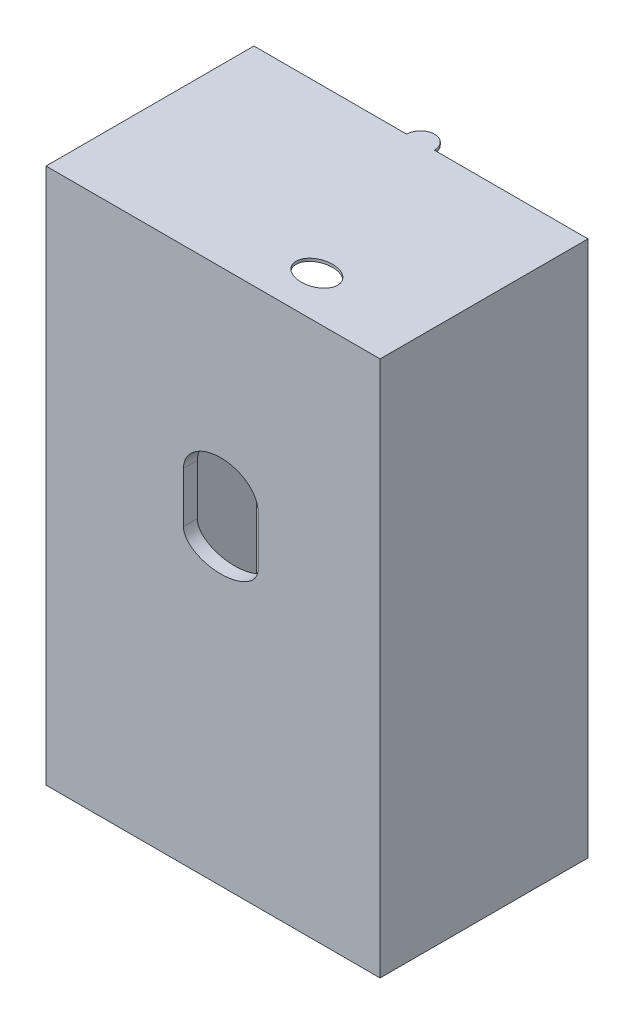
from build123d import *

# Parameters (mm, degrees)
SKETCH1_W               = 120.517011816
SKETCH1_H               = 193.423301163
BOSS_EXTRUDE1_DEPTH     = 75
SKETCH1_3_W             = 118.517011816
SKETCH1_3_H             = 191.423301163
CUT_EXTRUDE1_DEPTH      = 70
BOSS_EXTRUDE2_DEPTH     = 1
CUT_EXTRUDE4_DEPTH      = 137.495747048
CUT_EXTRUDE4_DEPTH_BACK = 137.495747048
CUT_EXTRUDE6_DEPTH      = 10


with BuildPart() as part:
    # Sketch1 → Boss-Extrude1 (new body)
    with BuildSketch(Plane.XY):
        with Locations((0.026299542, -0.057021664)):
            Rectangle(SKETCH1_W, SKETCH1_H)
    extrude(amount=BOSS_EXTRUDE1_DEPTH)

    # Sketch1<3> → Cut-Extrude1 (cut)
    with BuildSketch(Plane.XY):
        with Locations((0.026299542, -0.057021664)):
            Rectangle(SKETCH1_3_W, SKETCH1_3_H)
    extrude(amount=CUT_EXTRUDE1_DEPTH, mode=Mode.SUBTRACT)

    # Sketch2 → Boss-Extrude2 (add)
    with BuildSketch(Plane(origin=(0, 96.654628917, 0), x_dir=(1, 0, 0), z_dir=(0, 1, 0))):
        with BuildLine():
            Line((-5.120692539, 0), (4.878786885, 0))
            ThreePointArc((4.878786885, 0), (-0.120952827, 5.051017752), (-5.120692539, 0))
        make_face()
    extrude(amount=-BOSS_EXTRUDE2_DEPTH)

    # Sketch4<2> → Cut-Extrude4 (cut, two sides: drawn at the far end of the back side and taken through both)
    with BuildSketch(Plane(origin=(0, 0, 70), x_dir=(-1, 0, 0), z_dir=(0, 0, -1)).offset(-CUT_EXTRUDE4_DEPTH_BACK)):
        with BuildLine():
            Line((-16.236705508, 8.803847843), (-16.236705508, 26.966349614))
            add(Edge.make_bspline(
                [(10.654600955, 26.966349614), (10.654600955, 37.042694246), (-2.791052277, 37.042694246), (-16.236705508, 37.042694246), (-16.236705508, 26.966349614)],
                knots=[3.141592654, 3.141592654, 3.141592654, 4.71238898, 4.71238898, 6.283185307, 6.283185307, 6.283185307], degree=2, weights=[1, 0.707106781, 1, 0.707106781, 1]))
            Line((10.654600955, 26.966349614), (10.654600955, 8.803847843))
            add(Edge.make_bspline(
                [(-16.236705508, 8.803847843), (-16.236705508, 0.726850718), (-2.791052277, 0.726850718), (10.654600955, 0.726850718), (10.654600955, 8.803847843)],
                knots=[0, 0, 0, 1.570796327, 1.570796327, 3.141592654, 3.141592654, 3.141592654], degree=2, weights=[1, 0.707106781, 1, 0.707106781, 1]))
        make_face()
    extrude(amount=CUT_EXTRUDE4_DEPTH + CUT_EXTRUDE4_DEPTH_BACK, mode=Mode.SUBTRACT)

    # Sketch6 → Cut-Extrude6 (cut, symmetric)
    with BuildSketch(Plane(origin=(0, 96.654628917, 0), x_dir=(1, 0, 0), z_dir=(0, 1, 0))):
        with BuildLine():
            add(Edge.make_bspline(
                [(14.607126744, -59.625274066), (14.607126744, -59.996423236), (14.655753616, -60.360654617), (14.797863596, -60.897161426), (14.856849596, -61.074344505), (14.9984446, -61.42534999), (15.081484622, -61.59993657), (15.36467279, -62.113067792), (15.595340891, -62.436179632), (16.002179988, -62.893279801), (16.148006268, -63.041018505), (16.460654262, -63.326982062), (16.627232407, -63.464794132), (17.147507806, -63.854923379), (17.524850755, -64.087300386), (18.13663611, -64.394273167), (18.349476527, -64.490080589), (18.784383, -64.664483705), (19.006061662, -64.743067855), (19.683439186, -64.953650763), (20.15136039, -65.060723061), (21.120984475, -65.205972716), (21.610951465, -65.242067863), (22.343801341, -65.24262469), (22.588258242, -65.23389357), (23.07752571, -65.198266478), (23.323602223, -65.171129385), (24.04825359, -65.063568363), (24.515989992, -64.95745801), (25.42125883, -64.677606952), (25.862082399, -64.501556566), (26.676946551, -64.094389908), (27.055163448, -63.862622522), (27.577987155, -63.47204045), (27.745226091, -63.334101772), (28.057458003, -63.04956749), (28.20337387, -62.902368403), (28.611107489, -62.446258784), (28.843853735, -62.121803074), (29.223293972, -61.437507678), (29.365303175, -61.086770508), (29.50923045, -60.548226995), (29.545607426, -60.366624344), (29.594557113, -59.999133521), (29.606945323, -59.813278674), (29.607483579, -59.261578321), (29.560066597, -58.897421315), (29.417460244, -58.356636708), (29.357535803, -58.176377178), (29.214631397, -57.822433786), (29.132057014, -57.649371871), (28.851902237, -57.14158682), (28.62220127, -56.818155033), (28.211284873, -56.35633663), (28.063808332, -56.207204664), (27.752933385, -55.923051914), (27.424862325, -55.651543664), (27.062811294, -55.405021279), (26.683482778, -55.171203227), (26.483999533, -55.060101063), (25.869660817, -54.752095839), (25.43867317, -54.579379415), (24.534710357, -54.297863736), (24.056862603, -54.188834821), (23.095878735, -54.045053542), (22.609683495, -54.008631963), (21.871731404, -54.007851656), (21.623217783, -54.016782482), (21.133474519, -54.052593794), (20.891228101, -54.079395605), (20.172200955, -54.185935333), (19.702248556, -54.291799913), (18.786992965, -54.574854931), (18.355286434, -54.747702842), (17.745137882, -55.052178339), (17.548036265, -55.161259722), (17.166702804, -55.394972905), (16.982301592, -55.51989473), (16.460673231, -55.909894482), (16.150371394, -56.192508636), (15.604234807, -56.802703679), (15.368452042, -57.132300307), (14.993164183, -57.809021831), (14.850249749, -58.159277139), (14.656312657, -58.884223774), (14.607126744, -59.254124896), (14.607126744, -59.625274066)],
                knots=[0, 0, 0, 0, 0.03125, 0.03125, 0.046875, 0.046875, 0.0625, 0.0625, 0.09375, 0.09375, 0.109375, 0.109375, 0.125, 0.125, 0.15625, 0.15625, 0.171875, 0.171875, 0.1875, 0.1875, 0.21875, 0.21875, 0.25, 0.25, 0.265625, 0.265625, 0.28125, 0.28125, 0.3125, 0.3125, 0.34375, 0.34375, 0.375, 0.375, 0.390625, 0.390625, 0.40625, 0.40625, 0.4375, 0.4375, 0.46875, 0.46875, 0.484375, 0.484375, 0.5, 0.5, 0.53125, 0.53125, 0.546875, 0.546875, 0.5625, 0.5625, 0.59375, 0.59375, 0.609375, 0.609375, 0.625, 0.640625, 0.640625, 0.65625, 0.65625, 0.6875, 0.6875, 0.71875, 0.71875, 0.75, 0.75, 0.765625, 0.765625, 0.78125, 0.78125, 0.8125, 0.8125, 0.84375, 0.84375, 0.859375, 0.859375, 0.875, 0.875, 0.90625, 0.90625, 0.9375, 0.9375, 0.96875, 0.96875, 1, 1, 1, 1], degree=3))
        make_face()
    extrude(amount=CUT_EXTRUDE6_DEPTH, both=True, mode=Mode.SUBTRACT)


solid = part.part
